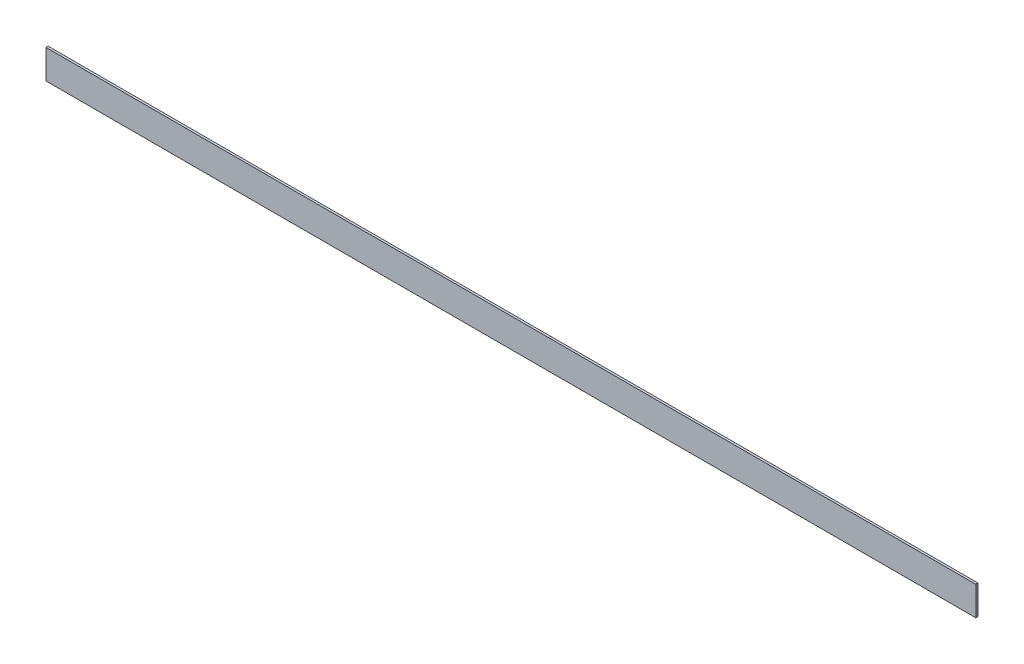
from build123d import *

# Parameters (mm, degrees)
PACK_PANEL_UST_PAY_1_START = 38.5
SKETCH1_W                  = 640
SKETCH1_H                  = 20
PACK_PANEL_UST_PAY_1_DEPTH = 1.5


with BuildPart() as part:
    # Sketch1 → PACK_panel_ust_pay_1 (new body)
    with BuildSketch(Plane.XY.offset(PACK_PANEL_UST_PAY_1_START)):
        with Locations((350, 1960)):
            Rectangle(SKETCH1_W, SKETCH1_H)
    extrude(amount=PACK_PANEL_UST_PAY_1_DEPTH)


solid = part.part
